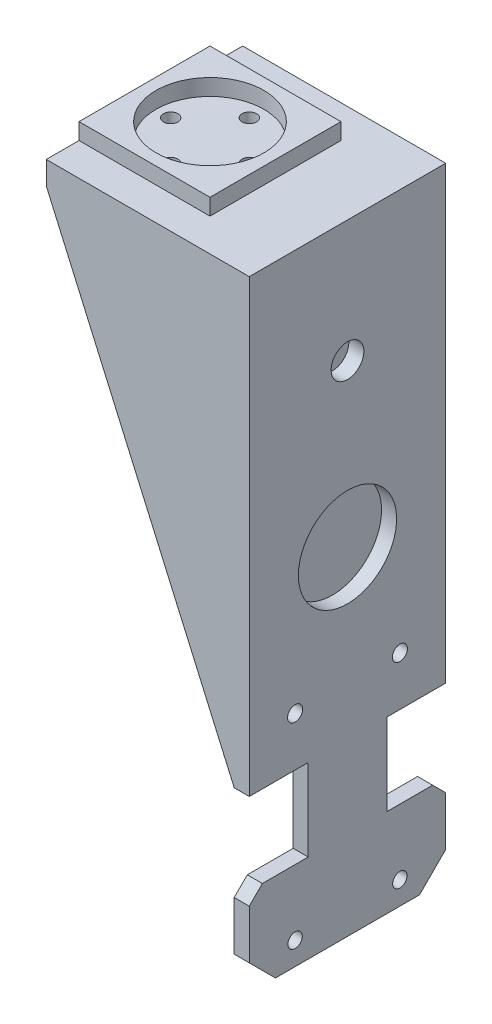
from build123d import *

# Parameters (mm, degrees)
SKETCH_1_W            = 30
SKETCH_1_H            = 30
EXTRUDE_1_DEPTH       = 86.25
SKETCH_2_R            = 8.25
CUT_EXTRUDE_1_DEPTH   = 2.5
SKETCH_3_W            = 10
SKETCH_3_H            = 66.25
SKETCH_3_H_2          = 20
CUT_EXTRUDE_2_DEPTH   = 93.542220094
SKETCH_4_W            = 10
SKETCH_4_H            = 20
EXTRUDE_2_DEPTH       = 30
SKETCH_5_W            = 7
SKETCH_5_H            = 86.25
EXTRUDE_3_DEPTH       = 30
SKETCH_6_W            = 27
SKETCH_6_H            = 30
EXTRUDE_4_DEPTH       = 11
SKETCH_7_W            = 20.5
SKETCH_7_H            = 36
CUT_EXTRUDE_3_DEPTH   = 24.7
SKETCH_8_R            = 1.1
SKETCH_8_R_2          = 1.15
CUT_EXTRUDE_4_DEPTH   = 23
SKETCH_9_R            = 8.25
CUT_EXTRUDE_5_DEPTH   = 2.5
SKETCH_10_R           = 1.1
CUT_EXTRUDE_6_DEPTH   = 10
CUT_EXTRUDE_7_DEPTH   = 94.931158302
SKETCH_12_W           = 4.75
SKETCH_12_H           = 91.25
EXTRUDE_5_DEPTH       = 28.7
SKETCH_14_W           = 20.5
SKETCH_14_H           = 5
EXTRUDE_6_DEPTH       = 28.7
CUT_EXTRUDE_9_DEPTH   = 94.931158302
CHAMFER_1_SIZE        = 4
SKETCH_15_R           = 7.5
SKETCH_15_R_2         = 2.5
CUT_EXTRUDE_10_DEPTH  = 93.128999235
SKETCH_16_W           = 9
SKETCH_16_H           = 12.5
CUT_EXTRUDE_11_DEPTH  = 10
CHAMFER_2_SIZE        = 2
SKETCH_18_OUTSIDE_W   = 54.278
SKETCH_18_OUTSIDE_H   = 53.278
SKETCH_18_OUTSIDE_W_2 = 20
SKETCH_18_OUTSIDE_H_2 = 20
CUT_EXTRUDE_12_DEPTH  = 2.5


with BuildPart() as part:
    # 草图1 → 凸台-拉伸1 (new body)
    with BuildSketch(Plane(origin=(0, 0, 0), x_dir=(1, 0, 0), z_dir=(0, 1, 0))):
        Rectangle(SKETCH_1_W, SKETCH_1_H)
    extrude(amount=EXTRUDE_1_DEPTH)

    # 草图2 → 切除-拉伸1 (cut)
    with BuildSketch(Plane(origin=(0, 86.25, 0), x_dir=(1, 0, 0), z_dir=(0, 1, 0))):
        with Locations(Location((1, 0, 0), (0, 0, 270))):
            Circle(SKETCH_2_R)
    extrude(amount=-CUT_EXTRUDE_1_DEPTH, mode=Mode.SUBTRACT)

    # 草图3 → 切除-拉伸2 (cut, through all)
    with BuildSketch(Plane(origin=(0, 0, -15), x_dir=(-1, 0, 0), z_dir=(0, 0, -1))):
        with Locations((10, 33.125)):
            Rectangle(SKETCH_3_W, SKETCH_3_H)
        with Locations((-10, 76.25)):
            Rectangle(SKETCH_3_W, SKETCH_3_H_2)
    extrude(amount=-CUT_EXTRUDE_2_DEPTH, mode=Mode.SUBTRACT)

    # 草图4 → 凸台-拉伸2 (add, through all)
    with BuildSketch(Plane(origin=(0, 0, -15), x_dir=(-1, 0, 0), z_dir=(0, 0, -1))):
        with Locations((-10, 76.25)):
            Rectangle(SKETCH_4_W, SKETCH_4_H)
    extrude(amount=-EXTRUDE_2_DEPTH)

    # 草图5 → 凸台-拉伸3 (add, through all)
    with BuildSketch(Plane(origin=(0, 0, -15), x_dir=(-1, 0, 0), z_dir=(0, 0, -1))):
        with Locations((-18.5, 43.125)):
            Rectangle(SKETCH_5_W, SKETCH_5_H)
    extrude(amount=-EXTRUDE_3_DEPTH)

    # 草图6 → 凸台-拉伸4 (add)
    with BuildSketch(Plane.XZ):
        with Locations((8.5, 0)):
            Rectangle(SKETCH_6_W, SKETCH_6_H)
    extrude(amount=EXTRUDE_4_DEPTH)

    # 草图7 → 切除-拉伸3 (cut)
    with BuildSketch(Plane.ZY.offset(5)):
        with Locations((0, 7)):
            Rectangle(SKETCH_7_W, SKETCH_7_H)
    extrude(amount=-CUT_EXTRUDE_3_DEPTH, mode=Mode.SUBTRACT)

    # 草图8 → 切除-拉伸4 (cut)
    with BuildSketch(Plane.ZY.offset(-19.7)):
        with Locations((-8, -7.5)):
            Circle(SKETCH_8_R)
        with Locations((-8, 22.5)):
            Circle(SKETCH_8_R_2)
        with Locations(Location((8, 22.5, 0), (0, 0, 180))):
            Circle(SKETCH_8_R_2)
        with Locations(Location((8, -7.5, 0), (0, 0, 180))):
            Circle(SKETCH_8_R)
    extrude(amount=-CUT_EXTRUDE_4_DEPTH, mode=Mode.SUBTRACT)

    # 草图9 → 切除-拉伸5 (cut)
    with BuildSketch(Plane(origin=(0, 86.25, 0), x_dir=(1, 0, 0), z_dir=(0, 1, 0))):
        with Locations(Location((1, 0, 0), (0, 0, 270))):
            Circle(SKETCH_9_R)
    extrude(amount=-CUT_EXTRUDE_5_DEPTH, mode=Mode.SUBTRACT)

    # 草图10 → 切除-拉伸6 (cut)
    with BuildSketch(Plane(origin=(0, 83.75, 0), x_dir=(1, 0, 0), z_dir=(0, 1, 0))):
        with Locations(Location((1, 6, 0), (0, 0, 270))):
            Circle(SKETCH_10_R)
        with Locations(Location((7, 0, 0), (0, 0, 270))):
            Circle(SKETCH_10_R)
        with Locations(Location((1, -6, 0), (0, 0, 90))):
            Circle(SKETCH_10_R)
        with Locations(Location((-5, 0, 0), (0, 0, 90))):
            Circle(SKETCH_10_R)
    extrude(amount=-CUT_EXTRUDE_6_DEPTH, mode=Mode.SUBTRACT)

    # 草图11 → 切除-拉伸7 (cut, through all)
    with BuildSketch(Plane(origin=(0, 0, -15), x_dir=(-1, 0, 0), z_dir=(0, 0, -1))):
        Polygon((9, 86.25), (9, 80.25), (-18, 80.25), (-18, -11), (15, -11), (15, 86.25), align=None)
    extrude(amount=-CUT_EXTRUDE_7_DEPTH, mode=Mode.SUBTRACT)

    # 草图12 → 凸台-拉伸5 (add, through all)
    with BuildSketch(Plane.ZY.offset(-19.7)):
        with Locations((-12.625, 34.625)):
            Rectangle(SKETCH_12_W, SKETCH_12_H)
        with Locations((12.625, 34.625)):
            Rectangle(SKETCH_12_W, SKETCH_12_H)
    extrude(amount=EXTRUDE_5_DEPTH)

    # 草图14 → 凸台-拉伸6 (add, through all)
    with BuildSketch(Plane.ZY.offset(-19.7)):
        with Locations((0, 27.5)):
            Rectangle(SKETCH_14_W, SKETCH_14_H)
    extrude(amount=EXTRUDE_6_DEPTH)

    # 草图13 → 切除-拉伸9 (cut, through all)
    with BuildSketch(Plane(origin=(0, 0, -15), x_dir=(-1, 0, 0), z_dir=(0, 0, -1))):
        Polygon((9, 80.25), (-19.7, 15), (-19.7, -11), (9, -11), align=None)
    extrude(amount=-CUT_EXTRUDE_9_DEPTH, mode=Mode.SUBTRACT)

    # 倒角1
    chamfer_1_edges = [part.edges().sort_by_distance(p)[0] for p in [
        (20.85, -11, -15),
        (20.85, -11, 15),
    ]]
    chamfer(chamfer_1_edges, length=CHAMFER_1_SIZE)

    # 草图15 → 切除-拉伸10 (cut, through all)
    with BuildSketch(Plane.ZY.offset(-19.7)):
        with Locations((0, 40.482891964)):
            Circle(SKETCH_15_R)
        with Locations((0, 65.138202804)):
            Circle(SKETCH_15_R_2)
    extrude(amount=-CUT_EXTRUDE_10_DEPTH, mode=Mode.SUBTRACT)

    # 草图16 → 切除-拉伸11 (cut)
    with BuildSketch(Plane.ZY.offset(-19.7)):
        with Locations((10.5, 8.75)):
            Rectangle(SKETCH_16_W, SKETCH_16_H)
        with Locations((-10.5, 8.75)):
            Rectangle(SKETCH_16_W, SKETCH_16_H)
    extrude(amount=-CUT_EXTRUDE_11_DEPTH, mode=Mode.SUBTRACT)

    # 倒角2
    chamfer_2_edges = [part.edges().sort_by_distance(p)[0] for p in [
        (20.85, 2.5, -15),
        (20.85, 2.5, 15),
    ]]
    chamfer(chamfer_2_edges, length=CHAMFER_2_SIZE)

    # 草图18 outside → 切除-拉伸12 (cut)
    with BuildSketch(Plane(origin=(0, 86.25, 0), x_dir=(1, 0, 0), z_dir=(0, 1, 0))):
        with Locations((6.5, 0)):
            Rectangle(SKETCH_18_OUTSIDE_W, SKETCH_18_OUTSIDE_H)
        with Locations((1, 0)):
            Rectangle(SKETCH_18_OUTSIDE_W_2, SKETCH_18_OUTSIDE_H_2, mode=Mode.SUBTRACT)
    extrude(amount=-CUT_EXTRUDE_12_DEPTH, mode=Mode.SUBTRACT)


solid = part.part
